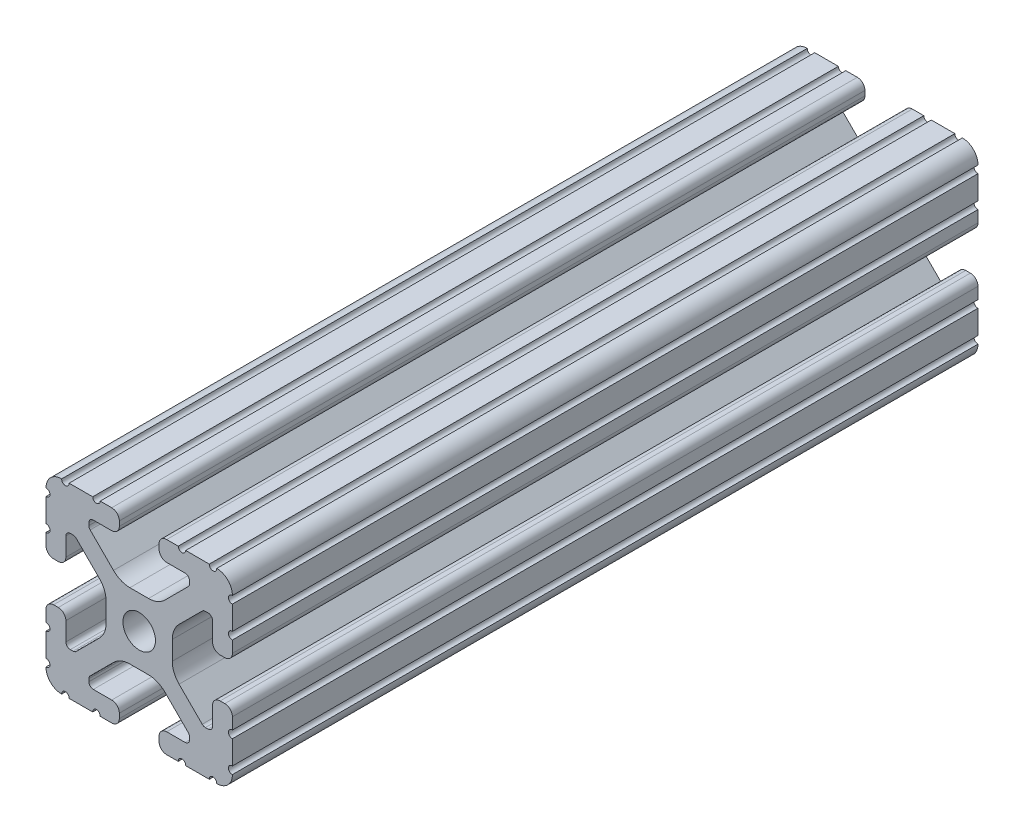
from build123d import *

# Parameters (mm, degrees)
SKETCH1_R      = 3.3274
EXTRUDE1_DEPTH = 152.4


with BuildPart() as part:
    # Sketch1 → Extrude1 (new body)
    with BuildSketch(Plane.XY):
        with BuildLine():
            Line((-10.022898969, 12.91475973), (-5.252158105, 8.144007132))
            ThreePointArc((-5.252158105, 8.144007132), (-3.715177372, 7.117027388), (-1.902183975, 6.7564))
            Line((-1.902183975, 6.7564), (1.902183975, 6.7564))
            ThreePointArc((1.902183975, 6.7564), (3.715177372, 7.117027388), (5.252158105, 8.144007132))
            Line((5.252158105, 8.144007132), (10.022898969, 12.91475973))
            ThreePointArc((10.022898969, 12.91475973), (10.218362387, 13.207291992), (10.287, 13.552357131))
            Line((10.287, 13.552357131), (10.287, 14.0843))
            ThreePointArc((10.287, 14.0843), (10.022898185, 14.721898185), (9.3853, 14.986))
            Line((9.3853, 14.986), (5.617617549, 14.986))
            ThreePointArc((5.617617549, 14.986), (4.519044045, 15.441044045), (4.064, 16.539617549))
            Line((4.064, 16.539617549), (4.064, 17.496382451))
            ThreePointArc((4.064, 17.496382451), (4.519044045, 18.594955955), (5.617617549, 19.05))
            Line((5.617617549, 19.05), (7.974178704, 19.05))
            ThreePointArc((7.974178704, 19.05), (8.736178704, 18.288), (9.498178704, 19.05))
            Line((9.498178704, 19.05), (14.327719207, 19.05))
            ThreePointArc((14.327719207, 19.05), (15.087603123, 18.231251131), (15.847487039, 19.05))
            ThreePointArc((15.847487039, 19.05), (18.120176289, 18.120192083), (19.05, 15.847509295))
            ThreePointArc((19.05, 15.847509295), (18.231250992, 15.08762539), (19.05, 14.327741484))
            Line((19.05, 14.327741484), (19.05, 9.496091471))
            ThreePointArc((19.05, 9.496091471), (18.231250992, 8.736207565), (19.05, 7.97632366))
            Line((19.05, 7.97632366), (19.05, 5.617617549))
            ThreePointArc((19.05, 5.617617549), (18.594955955, 4.519044045), (17.496382451, 4.064))
            Line((17.496382451, 4.064), (16.539617549, 4.064))
            ThreePointArc((16.539617549, 4.064), (15.441044045, 4.519044045), (14.986, 5.617617549))
            Line((14.986, 5.617617549), (14.986, 9.385342516))
            ThreePointArc((14.986, 9.385342516), (14.721898185, 10.022940701), (14.0843, 10.287042516))
            Line((14.0843, 10.287042516), (13.516042086, 10.287042516))
            ThreePointArc((13.516042086, 10.287042516), (13.170975923, 10.218404478), (12.878443117, 10.022939917))
            Line((12.878443117, 10.022939917), (8.14758008, 5.292065243))
            ThreePointArc((8.14758008, 5.292065243), (7.117955879, 3.751120653), (6.7564, 1.933453584))
            Line((6.7564, 1.933453584), (6.7564, -1.933453584))
            ThreePointArc((6.7564, -1.933453584), (7.117955879, -3.751120653), (8.14758008, -5.292065243))
            Line((8.14758008, -5.292065243), (12.878443117, -10.022939917))
            ThreePointArc((12.878443117, -10.022939917), (13.170975923, -10.218404478), (13.516042086, -10.287042516))
            Line((13.516042086, -10.287042516), (14.0843, -10.287042516))
            ThreePointArc((14.0843, -10.287042516), (14.721898185, -10.022940701), (14.986, -9.385342516))
            Line((14.986, -9.385342516), (14.986, -5.617617549))
            ThreePointArc((14.986, -5.617617549), (15.441044045, -4.519044045), (16.539617549, -4.064))
            Line((16.539617549, -4.064), (17.496382451, -4.064))
            ThreePointArc((17.496382451, -4.064), (18.594955955, -4.519044045), (19.05, -5.617617549))
            Line((19.05, -5.617617549), (19.05, -7.976318491))
            ThreePointArc((19.05, -7.976318491), (18.231250992, -8.736202396), (19.05, -9.496086302))
            Line((19.05, -9.496086302), (19.05, -14.32774291))
            ThreePointArc((19.05, -14.32774291), (18.231250992, -15.087626816), (19.05, -15.847510721))
            ThreePointArc((19.05, -15.847510721), (18.120175716, -18.120192644), (15.847486868, -19.05))
            ThreePointArc((15.847486868, -19.05), (15.087602952, -18.231251131), (14.327719036, -19.05))
            Line((14.327719036, -19.05), (9.496062448, -19.05))
            ThreePointArc((9.496062448, -19.05), (8.736178532, -18.231251131), (7.976294616, -19.05))
            Line((7.976294616, -19.05), (5.617617549, -19.05))
            ThreePointArc((5.617617549, -19.05), (4.519044045, -18.594955955), (4.064, -17.496382451))
            Line((4.064, -17.496382451), (4.064, -16.539617549))
            ThreePointArc((4.064, -16.539617549), (4.519044045, -15.441044045), (5.617617549, -14.986))
            Line((5.617617549, -14.986), (9.3853, -14.986))
            ThreePointArc((9.3853, -14.986), (10.022898185, -14.721898185), (10.287, -14.0843))
            Line((10.287, -14.0843), (10.287, -13.552357131))
            ThreePointArc((10.287, -13.552357131), (10.218362387, -13.207291992), (10.022898969, -12.91475973))
            Line((10.022898969, -12.91475973), (5.252158105, -8.144007132))
            ThreePointArc((5.252158105, -8.144007132), (3.715177372, -7.117027388), (1.902183975, -6.7564))
            Line((1.902183975, -6.7564), (-1.902183975, -6.7564))
            ThreePointArc((-1.902183975, -6.7564), (-3.715177372, -7.117027388), (-5.252158105, -8.144007132))
            Line((-5.252158105, -8.144007132), (-10.022898969, -12.91475973))
            ThreePointArc((-10.022898969, -12.91475973), (-10.218362387, -13.207291992), (-10.287, -13.552357131))
            Line((-10.287, -13.552357131), (-10.287, -14.0843))
            ThreePointArc((-10.287, -14.0843), (-10.022898185, -14.721898185), (-9.3853, -14.986))
            Line((-9.3853, -14.986), (-5.617617549, -14.986))
            ThreePointArc((-5.617617549, -14.986), (-4.519044045, -15.441044045), (-4.064, -16.539617549))
            Line((-4.064, -16.539617549), (-4.064, -17.496382451))
            ThreePointArc((-4.064, -17.496382451), (-4.519044045, -18.594955955), (-5.617617549, -19.05))
            Line((-5.617617549, -19.05), (-7.976294616, -19.05))
            ThreePointArc((-7.976294616, -19.05), (-8.736178532, -18.231251131), (-9.496062448, -19.05))
            Line((-9.496062448, -19.05), (-14.327719036, -19.05))
            ThreePointArc((-14.327719036, -19.05), (-15.087602952, -18.231251131), (-15.847486868, -19.05))
            ThreePointArc((-15.847486868, -19.05), (-18.120175716, -18.120192644), (-19.05, -15.847510721))
            ThreePointArc((-19.05, -15.847510721), (-18.231250992, -15.087626816), (-19.05, -14.32774291))
            Line((-19.05, -14.32774291), (-19.05, -9.496086302))
            ThreePointArc((-19.05, -9.496086302), (-18.231250992, -8.736202396), (-19.05, -7.976318491))
            Line((-19.05, -7.976318491), (-19.05, -5.617617549))
            ThreePointArc((-19.05, -5.617617549), (-18.594955955, -4.519044045), (-17.496382451, -4.064))
            Line((-17.496382451, -4.064), (-16.539617549, -4.064))
            ThreePointArc((-16.539617549, -4.064), (-15.441044045, -4.519044045), (-14.986, -5.617617549))
            Line((-14.986, -5.617617549), (-14.986, -9.385342516))
            ThreePointArc((-14.986, -9.385342516), (-14.721898185, -10.022940701), (-14.0843, -10.287042516))
            Line((-14.0843, -10.287042516), (-13.516042086, -10.287042516))
            ThreePointArc((-13.516042086, -10.287042516), (-13.170975923, -10.218404478), (-12.878443117, -10.022939917))
            Line((-12.878443117, -10.022939917), (-8.14758008, -5.292065243))
            ThreePointArc((-8.14758008, -5.292065243), (-7.117955879, -3.751120653), (-6.7564, -1.933453584))
            Line((-6.7564, -1.933453584), (-6.7564, 1.933453584))
            ThreePointArc((-6.7564, 1.933453584), (-7.117955879, 3.751120653), (-8.14758008, 5.292065243))
            Line((-8.14758008, 5.292065243), (-12.878443117, 10.022939917))
            ThreePointArc((-12.878443117, 10.022939917), (-13.170975923, 10.218404478), (-13.516042086, 10.287042516))
            Line((-13.516042086, 10.287042516), (-14.0843, 10.287042516))
            ThreePointArc((-14.0843, 10.287042516), (-14.721898185, 10.022940701), (-14.986, 9.385342516))
            Line((-14.986, 9.385342516), (-14.986, 5.617617549))
            ThreePointArc((-14.986, 5.617617549), (-15.441044045, 4.519044045), (-16.539617549, 4.064))
            Line((-16.539617549, 4.064), (-17.496382451, 4.064))
            ThreePointArc((-17.496382451, 4.064), (-18.594955955, 4.519044045), (-19.05, 5.617617549))
            Line((-19.05, 5.617617549), (-19.05, 7.97632366))
            ThreePointArc((-19.05, 7.97632366), (-18.231250992, 8.736207565), (-19.05, 9.496091471))
            Line((-19.05, 9.496091471), (-19.05, 14.327741484))
            ThreePointArc((-19.05, 14.327741484), (-18.231250992, 15.08762539), (-19.05, 15.847509295))
            ThreePointArc((-19.05, 15.847509295), (-18.120176289, 18.120192083), (-15.847487039, 19.05))
            ThreePointArc((-15.847487039, 19.05), (-15.087603123, 18.231251131), (-14.327719207, 19.05))
            Line((-14.327719207, 19.05), (-9.498178704, 19.05))
            ThreePointArc((-9.498178704, 19.05), (-8.736178704, 18.288), (-7.974178704, 19.05))
            Line((-7.974178704, 19.05), (-5.617617549, 19.05))
            ThreePointArc((-5.617617549, 19.05), (-4.519044045, 18.594955955), (-4.064, 17.496382451))
            Line((-4.064, 17.496382451), (-4.064, 16.539617549))
            ThreePointArc((-4.064, 16.539617549), (-4.519044045, 15.441044045), (-5.617617549, 14.986))
            Line((-5.617617549, 14.986), (-9.3853, 14.986))
            ThreePointArc((-9.3853, 14.986), (-10.022898185, 14.721898185), (-10.287, 14.0843))
            Line((-10.287, 14.0843), (-10.287, 13.552357131))
            ThreePointArc((-10.287, 13.552357131), (-10.218362387, 13.207291992), (-10.022898969, 12.91475973))
        make_face()
        Circle(SKETCH1_R, mode=Mode.SUBTRACT)
    extrude(amount=-EXTRUDE1_DEPTH)


solid = part.part
